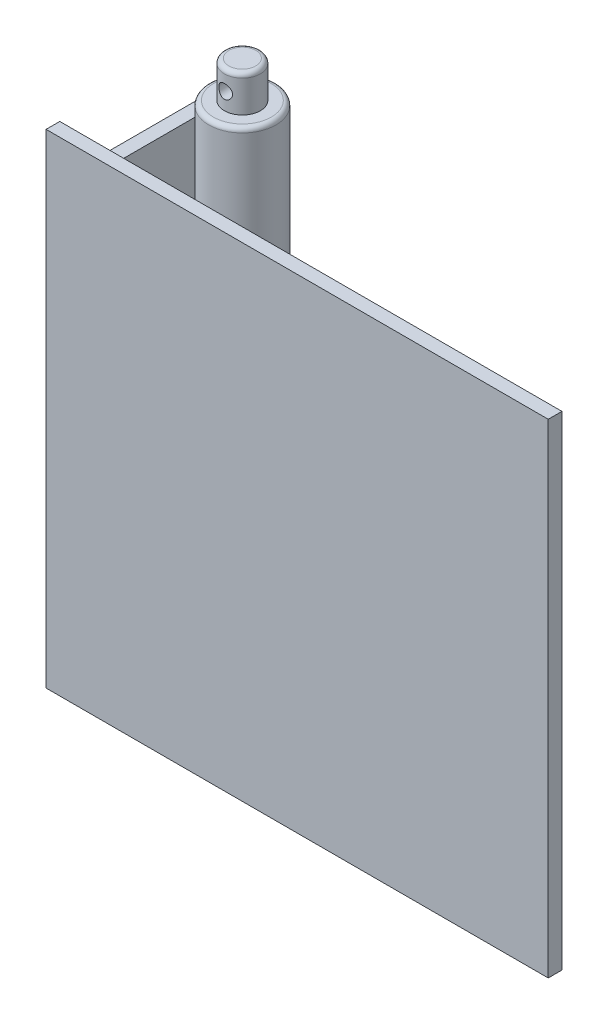
from build123d import *

# Parameters (mm, degrees)
SKETCH_1_W               = 110
SKETCH_1_H               = 106
EXTRUDE_1_DEPTH          = 3
SKETCH_2_W               = 3
SKETCH_2_H               = 94
EXTRUDE_2_DEPTH          = 38
EXTRUDE_3_DEPTH          = 5
EXTRUDE_3_DEPTH_BACK     = 104.122011
SKETCH_4_R               = 7.35
SKETCH_5_R               = 3.95
EXTRUDE_4_DEPTH          = 8
FILLET_2_R               = 1
CUT_EXTRUDE_1_DEPTH      = 155.044806793
CUT_EXTRUDE_1_DEPTH_BACK = 155.044806793
SKETCH_9_R               = 1.5
FILLET_3_R               = 0.5
SKETCH_11_W              = 3
SKETCH_11_H              = 94
CUT_EXTRUDE_3_DEPTH      = 12


with BuildPart() as part:
    # 草图1 → 凸台-拉伸1 (new body)
    with BuildSketch(Plane.XY):
        with Locations((55, 43)):
            Rectangle(SKETCH_1_W, SKETCH_1_H)
    extrude(amount=EXTRUDE_1_DEPTH)

    # 草图2 → 凸台-拉伸2 (add)
    with BuildSketch(Plane(origin=(0, 0, 0), x_dir=(-1, 0, 0), z_dir=(0, 0, -1))):
        with Locations((-6.5, 43)):
            Rectangle(SKETCH_2_W, SKETCH_2_H)
    extrude(amount=EXTRUDE_2_DEPTH)

    # 草图4 → 凸台-拉伸3 (add, two sides: drawn at the far end of the back side and taken through both)
    with BuildSketch(Plane(origin=(0, 90, 0), x_dir=(1, 0, 0), z_dir=(0, 1, 0)).offset(-EXTRUDE_3_DEPTH_BACK)):
        with Locations(Location((15, 25, 0), (0, 0, 270))):
            Circle(SKETCH_4_R)
    extrude(amount=EXTRUDE_3_DEPTH + EXTRUDE_3_DEPTH_BACK)

    # 草图5 → 凸台-拉伸4 (add)
    with BuildSketch(Plane(origin=(0, 95, 0), x_dir=(1, 0, 0), z_dir=(0, 1, 0))):
        with Locations(Location((15, 25, 0), (0, 0, 270))):
            Circle(SKETCH_5_R)
    extrude(amount=EXTRUDE_4_DEPTH)

    # 圆角2
    fillet_2_edges = [part.edges().sort_by_distance(p)[0] for p in [
        (15, 95, -32.35),
        (15, 103, -28.95),
    ]]
    fillet(fillet_2_edges, radius=FILLET_2_R)

    # 草图9 → 切除-拉伸1 (cut, two sides: drawn at the far end of the back side and taken through both)
    with BuildSketch(Plane(origin=(0, 0, -28.95), x_dir=(-1, 0, 0), z_dir=(0, 0, -1)).offset(-CUT_EXTRUDE_1_DEPTH_BACK)):
        with Locations(Location((-15, 98.677988735, 0), (0, 0, 90.000000013))):
            Circle(SKETCH_9_R)
    extrude(amount=CUT_EXTRUDE_1_DEPTH + CUT_EXTRUDE_1_DEPTH_BACK, mode=Mode.SUBTRACT)

    # 圆角3
    fillet_3_edges = [part.edges().sort_by_distance(p)[0] for p in [
        (15, -14.122011, -32.35),
    ]]
    fillet(fillet_3_edges, radius=FILLET_3_R)

    # 草图11 → 切除-拉伸3 (cut)
    with BuildSketch(Plane(origin=(0, 0, -38), x_dir=(-1, 0, 0), z_dir=(0, 0, -1))):
        with Locations((-6.5, 43)):
            Rectangle(SKETCH_11_W, SKETCH_11_H)
    extrude(amount=-CUT_EXTRUDE_3_DEPTH, mode=Mode.SUBTRACT)


solid = part.part
